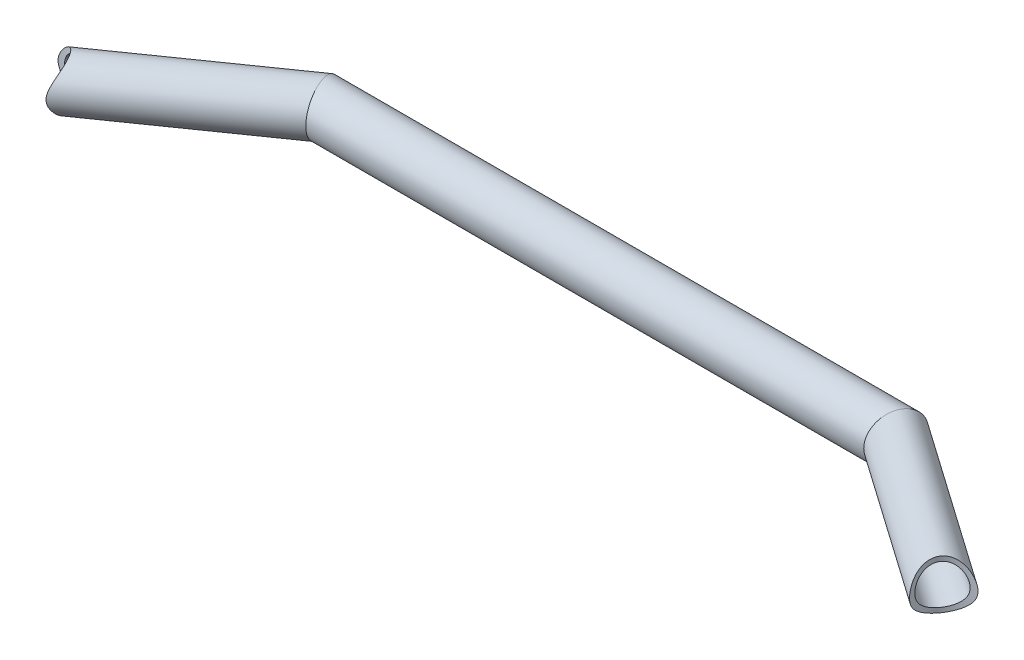
from build123d import *

# Parameters (mm, degrees)
ESBO_O2_R                  = 10.5
ESBO_O2_R_2                = 8.5
CORTE_EXTRUS_O1_DEPTH      = 205.674163986
CORTE_EXTRUS_O1_DEPTH_BACK = 205.674163986
ESBO_O3_R                  = 12.7


with BuildPart() as part:
    # Varredura1: sweep along a path in Esboço1
    with BuildLine(Plane(origin=(0, 0, 0), x_dir=(1, 0, 0), z_dir=(0, 1, 0))) as varredura1_path:
        Line((0, 0), (-122.5, 0))
        Line((-122.5, 0), (-190.5, -47.614112598))
    # Esboço2 → Varredura1 (sweep)
    with BuildSketch(Plane(origin=(0, 0, 0), x_dir=(0, 0, -1), z_dir=(1, 0, 0))):
        Circle(ESBO_O2_R)
        Circle(ESBO_O2_R_2, mode=Mode.SUBTRACT)
    varredura1 = sweep(path=varredura1_path.line, transition=Transition.RIGHT)

    # Espelhar1: Varredura1 across plane
    add(varredura1.mirror(Plane(origin=(0, 0, 0), x_dir=(0, 0, 1), z_dir=(1, 0, 0))))

    # Esboço3 → Corte-extrusão1 (cut, two sides: drawn at the far end of the back side and taken through both)
    with BuildSketch(Plane(origin=(0, 0, 0), x_dir=(1, 0, 0), z_dir=(0, 1, 0)).offset(-CORTE_EXTRUS_O1_DEPTH_BACK)):
        with Locations((196.352209331, -51.711873687)):
            Circle(ESBO_O3_R)
        with Locations((-196.352209331, -51.711873687)):
            Circle(ESBO_O3_R)
    extrude(amount=CORTE_EXTRUS_O1_DEPTH + CORTE_EXTRUS_O1_DEPTH_BACK, mode=Mode.SUBTRACT)


solid = part.part
